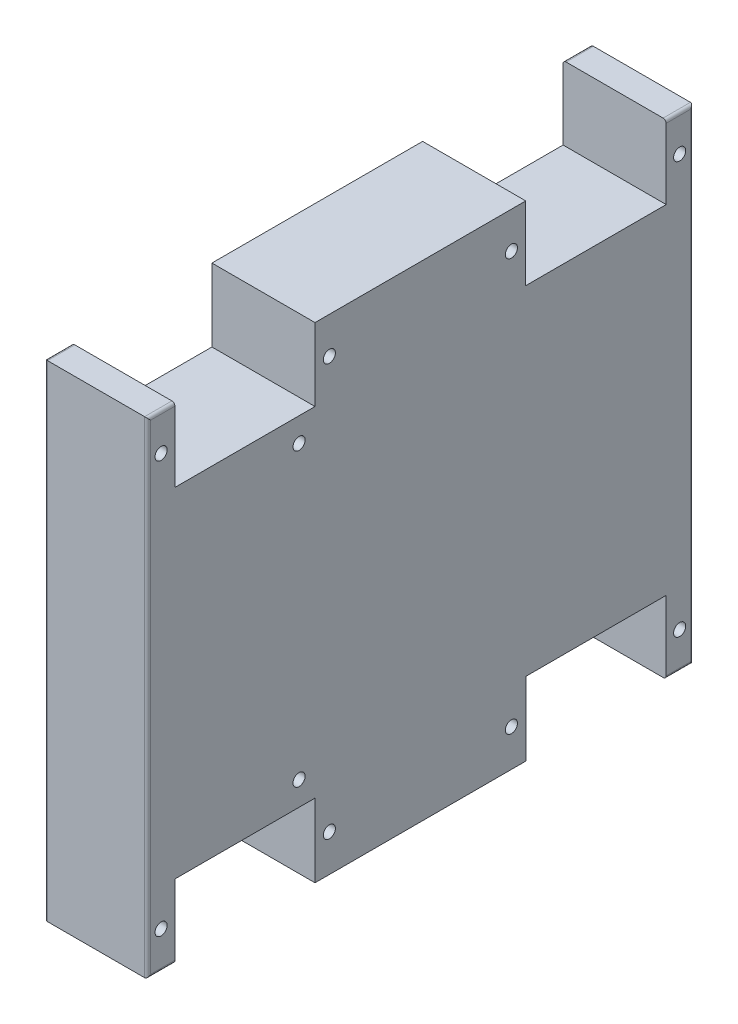
from build123d import *

# Parameters (mm, degrees)
SKETCH2_R           = 25.4
BOSS_EXTRUDE2_DEPTH = 431.8
SCALE1_SCALE        = 0.03937
FILLET2_R           = 0.5


with BuildPart() as part:
    # Sketch2 → Boss-Extrude2 (new body)
    with BuildSketch(Plane(origin=(0, 0, 0), x_dir=(0, 0, -1), z_dir=(1, 0, 0))):
        Polygon((-1142.280911006, -609.6), (-1142.280911006, -1017.438177988), (-1027.980911006, -1017.438177988), (-1027.980911006, -710.098177988), (-441.240911006, -710.098177988), (-441.240911006, -1017.438177988), (0, -1017.438177988), (442.679088994, -1017.438177988), (442.679088994, -710.098177988), (1029.419088994, -710.098177988), (1029.419088994, -1014.561822012), (1143.719088994, -1014.561822012), (1143.719088994, 1014.561822012), (1029.419088994, 1014.561822012), (1029.419088994, 707.221822012), (441.240911006, 707.221822012), (441.240911006, 1014.561822012), (-441.240911006, 1014.561822012), (-441.240911006, 710.098177988), (-1027.980911006, 710.098177988), (-1027.980911006, 1017.438177988), (-1142.280911006, 1017.438177988), (-1142.280911006, 460.3506922), (-1142.280911006, 0), align=None)
        with Locations((-1085.85, -862.33)):
            Circle(SKETCH2_R, mode=Mode.SUBTRACT)
        with Locations((-381.2428494, -862.33)):
            Circle(SKETCH2_R, mode=Mode.SUBTRACT)
        with Locations((-508, -609.6)):
            Circle(SKETCH2_R, mode=Mode.SUBTRACT)
        with Locations((381.2428494, -862.33)):
            Circle(SKETCH2_R, mode=Mode.SUBTRACT)
        with Locations((1085.85, -862.33)):
            Circle(SKETCH2_R, mode=Mode.SUBTRACT)
        with Locations((-1085.85, 862.33)):
            Circle(SKETCH2_R, mode=Mode.SUBTRACT)
        with Locations((-508, 609.6)):
            Circle(SKETCH2_R, mode=Mode.SUBTRACT)
        with Locations((-381.2428494, 862.33)):
            Circle(SKETCH2_R, mode=Mode.SUBTRACT)
        with Locations((381.2428494, 862.33)):
            Circle(SKETCH2_R, mode=Mode.SUBTRACT)
        with Locations((1085.85, 862.33)):
            Circle(SKETCH2_R, mode=Mode.SUBTRACT)
    extrude(amount=BOSS_EXTRUDE2_DEPTH)


with BuildPart() as part_1:
    # Scale1: scaled about (215.9, -1.065263606, -0.699579786)
    add(part.part.scale(SCALE1_SCALE).moved(Location((207.400017, -1.023324178, -0.67203733))))

    # Fillet2
    fillet2_edges = [part_1.edges().sort_by_distance(p)[0] for p in [
        (207.400017, -40.96662311, -43.450262364),
        (207.400017, -1.023324178, -45.700257864),
        (207.400017, 38.919974755, -43.450262364),
        (207.400017, 39.03321689, 42.049566636),
        (207.400017, -1.023324178, 44.299562136),
        (207.400017, -41.079865245, 42.049566636),
        (224.399983, -41.079865245, 42.049566636),
        (224.399983, -1.023324178, 44.299562136),
        (224.399983, 39.03321689, 42.049566636),
        (224.399983, 38.919974755, -43.450262364),
        (224.399983, -1.023324178, -45.700257864),
        (224.399983, -40.96662311, -43.450262364),
    ]]
    fillet(fillet2_edges, radius=FILLET2_R)


solid = part_1.part
